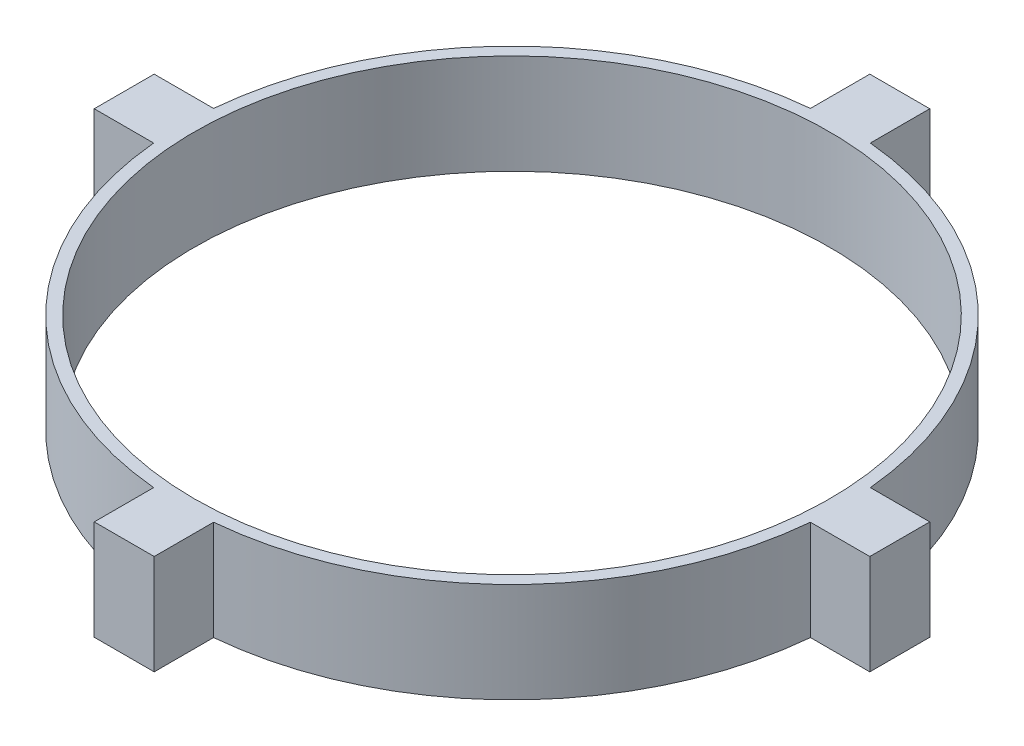
from build123d import *

# Parameters (mm, degrees)
SKETCH1_R           = 42.9384162
BOSS_EXTRUDE1_DEPTH = 12.7
SKETCH6_W           = 6.747965948
SKETCH6_H           = 12.700002404
BOSS_EXTRUDE2_DEPTH = 3.81
CIRPATTERN8_COUNT   = 4
CUT_EXTRUDE3_START  = -24
CUT_EXTRUDE3_DEPTH  = 24
SKETCH10_R          = 40.386
CUT_EXTRUDE4_DEPTH  = 38.1


with BuildPart() as part:
    # Sketch1 → Boss-Extrude1 (new body)
    with BuildSketch(Plane(origin=(0, 0, 0), x_dir=(1, 0, 0), z_dir=(0, 1, 0))):
        with Locations(Location((0, 0, 0), (0, 0, 270))):
            Circle(SKETCH1_R)
    extrude(amount=BOSS_EXTRUDE1_DEPTH)

    # Sketch6 → Boss-Extrude2 (add, symmetric)
    with BuildSketch(Plane.XY):
        with Locations((45.914433226, 6.349998798)):
            Rectangle(SKETCH6_W, SKETCH6_H)
    boss_extrude2 = extrude(amount=BOSS_EXTRUDE2_DEPTH, both=True)

    # CirPattern8: Boss-Extrude2 ×4 about axis
    cirpattern8_axis = Axis((0, 0, 0), (0, 1, 0))
    for i in range(1, CIRPATTERN8_COUNT):
        add(boss_extrude2.rotate(cirpattern8_axis, i * 360 / CIRPATTERN8_COUNT))

    # Sketch8 → Cut-Extrude3 (cut)
    with BuildSketch(Plane(origin=(0, 12.7, 0), x_dir=(1, 0, 0), z_dir=(0, 1, 0)).offset(CUT_EXTRUDE3_START)):
        with BuildLine():
            Line((-41.736458882, -3.81), (-42.769048222, -3.81))
            ThreePointArc((-42.769048222, -3.81), (-30.362045269, -30.362045269), (-3.81, -42.769048222))
            Line((-3.81, -42.769048222), (-3.81, -41.736458882))
            ThreePointArc((-3.81, -41.736458882), (-29.6348452, -29.6348452), (-41.736458882, -3.81))
        make_face()
        with BuildLine():
            Line((3.81, -41.736458882), (3.81, -42.769048222))
            ThreePointArc((3.81, -42.769048222), (30.362045269, -30.362045269), (42.769048222, -3.81))
            Line((42.769048222, -3.81), (41.736458882, -3.81))
            ThreePointArc((41.736458882, -3.81), (29.6348452, -29.6348452), (3.81, -41.736458882))
        make_face()
        with BuildLine():
            ThreePointArc((42.769048222, 3.81), (30.362045269, 30.362045269), (3.81, 42.769048222))
            Line((3.81, 42.769048222), (3.81, 41.736458882))
            ThreePointArc((3.81, 41.736458882), (29.6348452, 29.6348452), (41.736458882, 3.81))
            Line((41.736458882, 3.81), (42.769048222, 3.81))
        make_face()
        with BuildLine():
            ThreePointArc((-3.81, 42.769048222), (-30.362045269, 30.362045269), (-42.769048222, 3.81))
            Line((-42.769048222, 3.81), (-41.736458882, 3.81))
            ThreePointArc((-41.736458882, 3.81), (-29.6348452, 29.6348452), (-3.81, 41.736458882))
            Line((-3.81, 41.736458882), (-3.81, 42.769048222))
        make_face()
    extrude(amount=CUT_EXTRUDE3_DEPTH, mode=Mode.SUBTRACT)

    # Sketch10 → Cut-Extrude4 (cut)
    with BuildSketch(Plane(origin=(0, 12.7, 0), x_dir=(1, 0, 0), z_dir=(0, 1, 0))):
        with Locations(Location((0, 0, 0), (0, 0, 270))):
            Circle(SKETCH10_R)
    extrude(amount=-CUT_EXTRUDE4_DEPTH, mode=Mode.SUBTRACT)


solid = part.part
